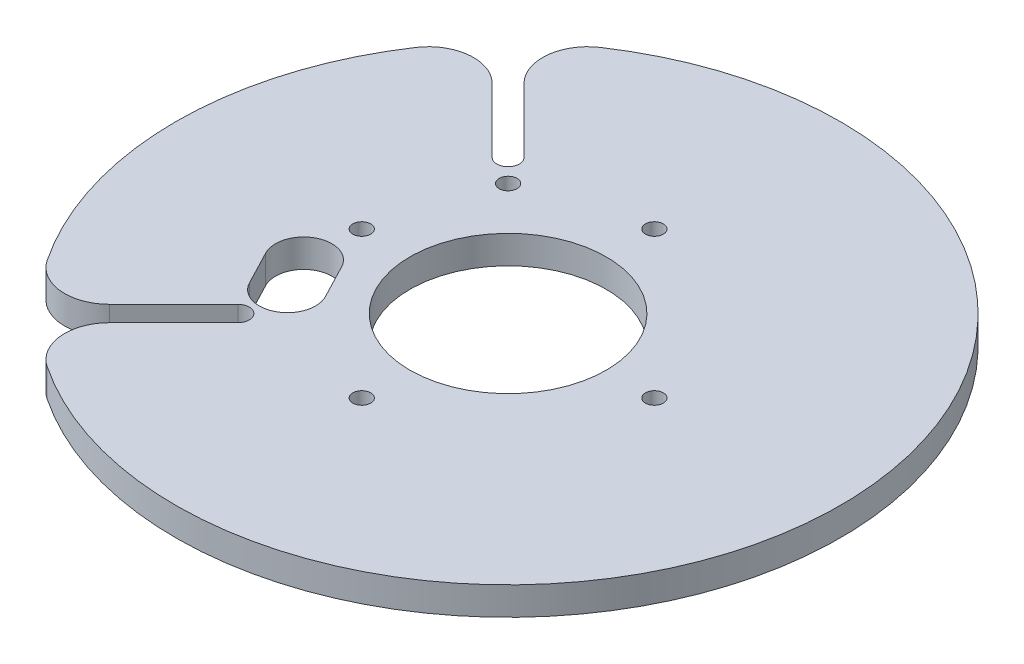
from build123d import *

# Parameters (mm, degrees)
SKETCH1_R           = 75
BOSS_EXTRUDE1_DEPTH = 6.35
SKETCH45_R          = 22.1615
SKETCH45_R_2        = 2.0193
CUT_EXTRUDE36_DEPTH = 107.255929246
FILLET2_R           = 10.16


with BuildPart() as part:
    # Sketch1 → Boss-Extrude1 (new body)
    with BuildSketch(Plane(origin=(0, 0, 0), x_dir=(1, 0, 0), z_dir=(0, 1, 0))):
        with Locations(Location((0, 0, 0), (0, 0, 270))):
            Circle(SKETCH1_R)
    extrude(amount=BOSS_EXTRUDE1_DEPTH)

    # Sketch45 → Cut-Extrude36 (cut, through all)
    with BuildSketch(Plane(origin=(0, 6.35, 0), x_dir=(1, 0, 0), z_dir=(0, 1, 0))):
        with Locations(Location((0, 0, 0), (0, 0, 270))):
            Circle(SKETCH45_R)
        with Locations(Location((-25.4, 25.4, 0), (0, 0, 270))):
            Circle(SKETCH45_R_2)
        with Locations(Location((0, 33.02, 0), (0, 0, 270))):
            Circle(SKETCH45_R_2)
        with Locations(Location((33.02, 0, 0), (0, 0, 270))):
            Circle(SKETCH45_R_2)
        with Locations(Location((0, -33.02, 0), (0, 0, 270))):
            Circle(SKETCH45_R_2)
        with Locations(Location((-33.02, 0, 0), (0, 0, 270))):
            Circle(SKETCH45_R_2)
        with BuildLine():
            Line((-27.903416949, -9.657564215), (-23.915755925, -17.31778977))
            ThreePointArc((-23.915755925, -17.31778977), (-26.616171022, -25.882412255), (-35.180793507, -23.181997158))
            Line((-35.180793507, -23.181997158), (-39.16845453, -15.521771603))
            ThreePointArc((-39.16845453, -15.521771603), (-36.468039434, -6.957149118), (-27.903416949, -9.657564215))
        make_face()
        with BuildLine():
            Line((-28.683948776, -32.276051224), (-51.236957365, -54.829059813))
            ThreePointArc((-51.236957365, -54.829059813), (-54.829059813, -54.829059813), (-54.829059813, -51.236957365))
            Line((-54.829059813, -51.236957365), (-32.276051224, -28.683948776))
            ThreePointArc((-32.276051224, -28.683948776), (-28.683948776, -28.683948776), (-28.683948776, -32.276051224))
        make_face()
        with BuildLine():
            Line((-32.276051224, 28.683948776), (-54.829059813, 51.236957365))
            ThreePointArc((-54.829059813, 51.236957365), (-54.829059813, 54.829059813), (-51.236957365, 54.829059813))
            Line((-51.236957365, 54.829059813), (-28.683948776, 32.276051224))
            ThreePointArc((-28.683948776, 32.276051224), (-28.683948776, 28.683948776), (-32.276051224, 28.683948776))
        make_face()
    extrude(amount=-CUT_EXTRUDE36_DEPTH, mode=Mode.SUBTRACT)

    # Fillet2
    fillet2_edges = [part.edges().sort_by_distance(p)[0] for p in [
        (-51.206535505, 3.175, 54.798637954),
        (-54.798637954, 3.175, 51.206535505),
        (-54.798637954, 3.175, -51.206535505),
        (-51.206535505, 3.175, -54.798637954),
    ]]
    fillet(fillet2_edges, radius=FILLET2_R)


solid = part.part
